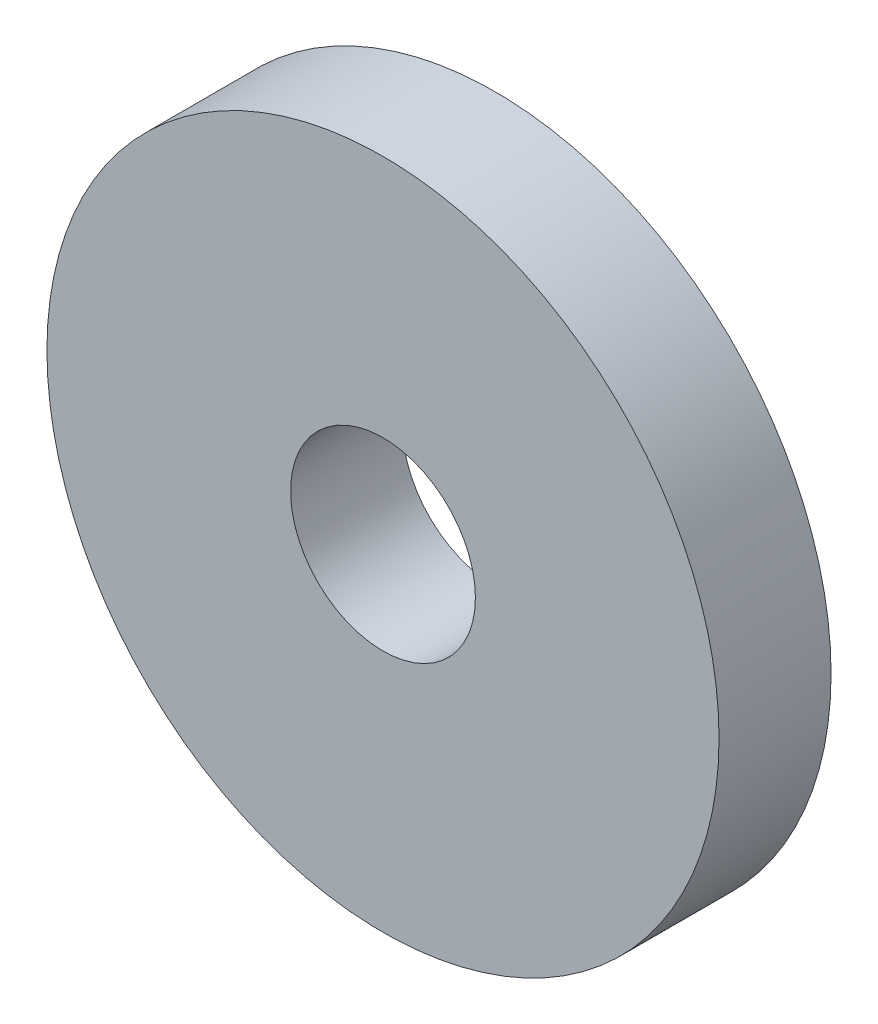
from build123d import *

# Parameters (mm, degrees)
SKETCH1_R           = 12
SKETCH1_R_2         = 3.3
BOSS_EXTRUDE1_DEPTH = 2


with BuildPart() as part:
    # Sketch1 → Boss-Extrude1 (new, symmetric)
    with BuildSketch(Plane.XY):
        Circle(SKETCH1_R)
        Circle(SKETCH1_R_2, mode=Mode.SUBTRACT)
    extrude(amount=BOSS_EXTRUDE1_DEPTH, both=True)


solid = part.part
